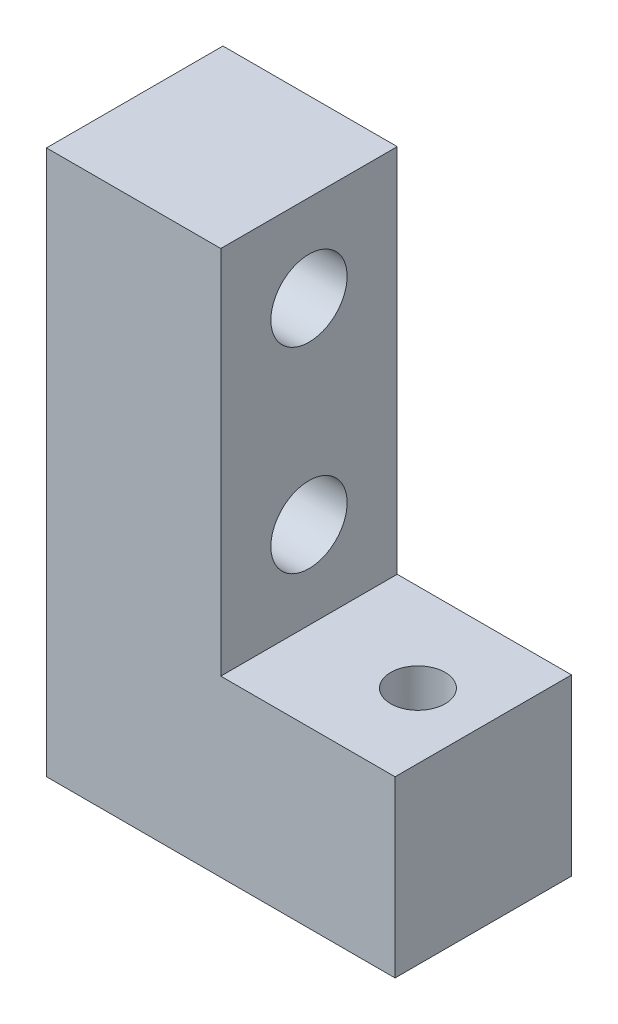
from build123d import *

# Parameters (mm, degrees)
ESQUISSE1_W             = 16
ESQUISSE1_H             = 25
BOSS_EXTRU_1_DEPTH      = 8.1
ESQUISSE2_R             = 1.25
ENL_V_MAT_EXTRU_1_DEPTH = 8
ESQUISSE3_R             = 1.75
ENL_V_MAT_EXTRU_2_DEPTH = 8
ESQUISSE4_W             = 8
ESQUISSE4_H             = 17
ENL_V_MAT_EXTRU_3_DEPTH = 31.767027806


with BuildPart() as part:
    # Esquisse1 → Boss.-Extru.1 (new body)
    with BuildSketch(Plane.XY):
        with Locations((8, 12.5)):
            Rectangle(ESQUISSE1_W, ESQUISSE1_H)
    extrude(amount=BOSS_EXTRU_1_DEPTH)

    # Esquisse2 → Enlèv. mat.-Extru.1 (cut)
    with BuildSketch(Plane.XZ):
        with Locations(Location((3, 4.05, 0), (0, 0, 270))):
            Circle(ESQUISSE2_R)
        with Locations(Location((13, 4.05, 0), (0, 0, 90))):
            Circle(ESQUISSE2_R)
    extrude(amount=-ENL_V_MAT_EXTRU_1_DEPTH, mode=Mode.SUBTRACT)

    # Esquisse3 → Enlèv. mat.-Extru.2 (cut)
    with BuildSketch(Plane.ZY):
        with Locations((4.05, 21)):
            Circle(ESQUISSE3_R)
        with Locations((4.05, 12)):
            Circle(ESQUISSE3_R)
    extrude(amount=-ENL_V_MAT_EXTRU_2_DEPTH, mode=Mode.SUBTRACT)

    # Esquisse4 → Enlèv. mat.-Extru.3 (cut, through all)
    with BuildSketch(Plane.XY.offset(8.1)):
        with Locations((12, 16.5)):
            Rectangle(ESQUISSE4_W, ESQUISSE4_H)
    extrude(amount=-ENL_V_MAT_EXTRU_3_DEPTH, mode=Mode.SUBTRACT)


solid = part.part
